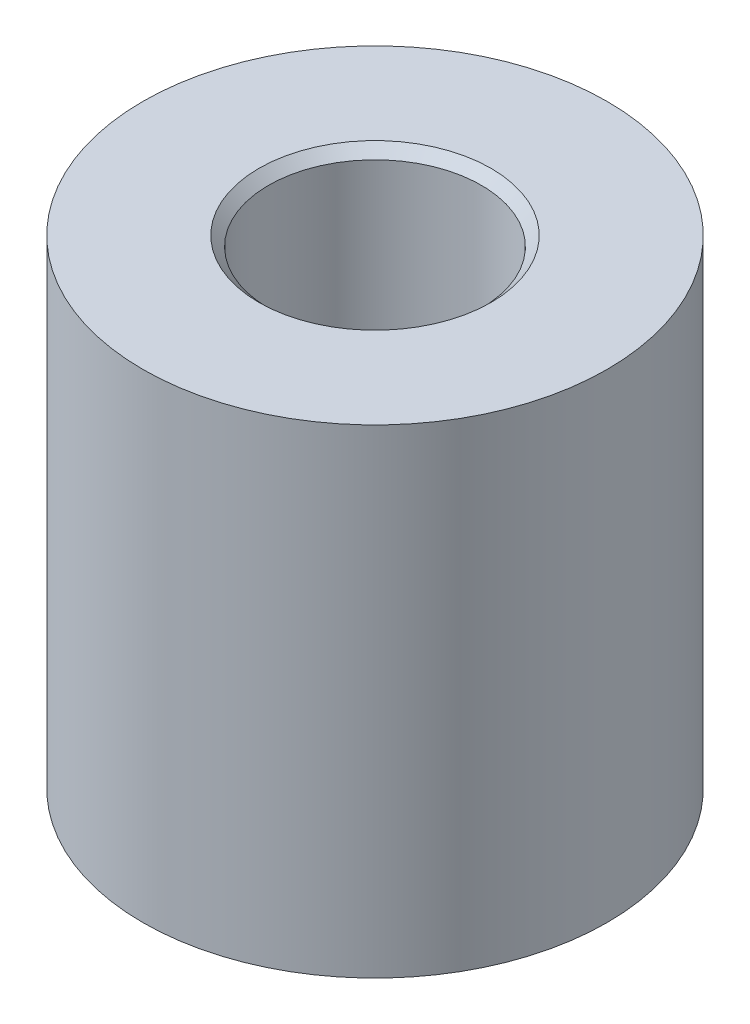
from build123d import *

# Parameters (mm, degrees)
SKETCH1_R           = 4.7625
SKETCH1_R_2         = 2.1828
BOSS_EXTRUDE1_DEPTH = 9.8290126
CHAMFER1_SIZE       = 0.2


with BuildPart() as part:
    # Sketch1 → Boss-Extrude1 (new body)
    with BuildSketch(Plane(origin=(0, 0, 0), x_dir=(1, 0, 0), z_dir=(0, 1, 0))):
        with Locations(Location((0, 0, 0), (0, 0, 270))):
            Circle(SKETCH1_R)
        with Locations(Location((0, 0, 0), (0, 0, 270))):
            Circle(SKETCH1_R_2, mode=Mode.SUBTRACT)
    extrude(amount=BOSS_EXTRUDE1_DEPTH)

    # Chamfer1
    chamfer1_edges = [part.edges().sort_by_distance(p)[0] for p in [
        (0, 0, -2.1828),
        (0, 9.8290126, -2.1828),
    ]]
    chamfer(chamfer1_edges, length=CHAMFER1_SIZE)


solid = part.part
